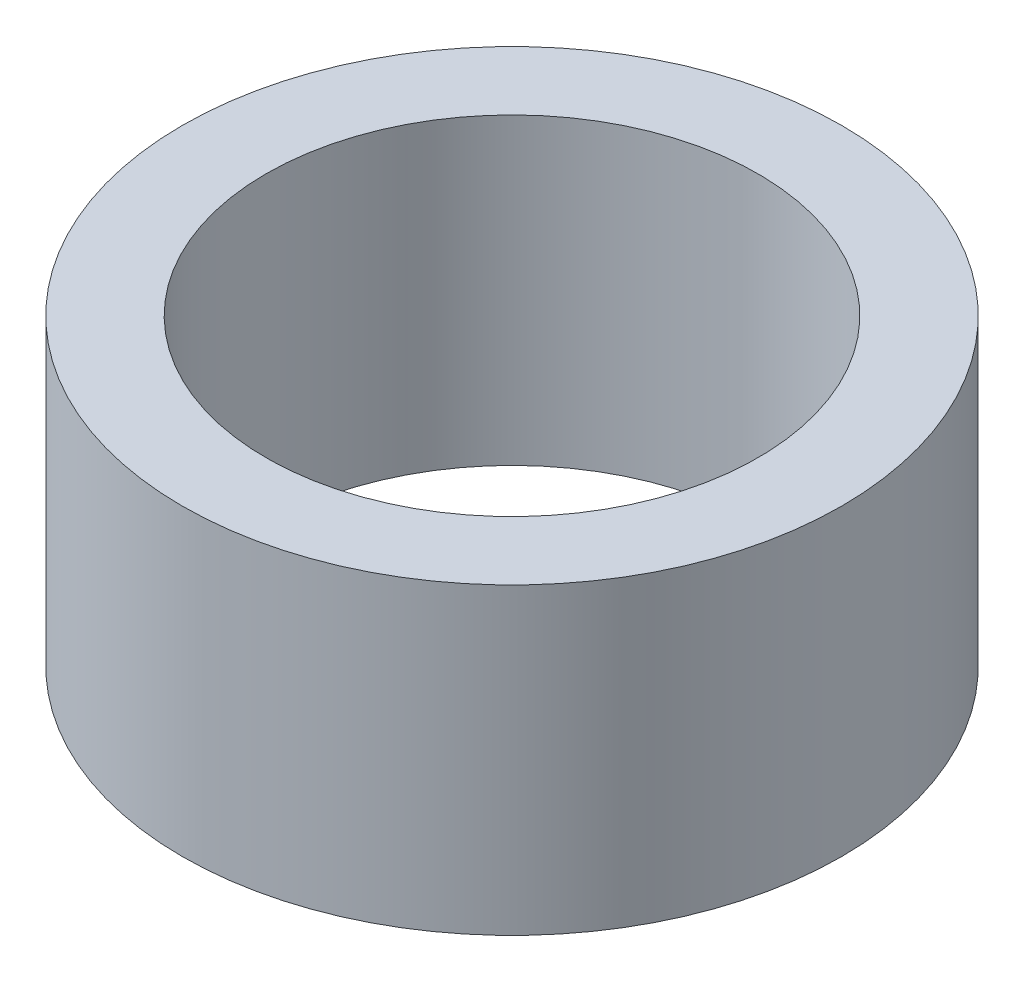
from build123d import *

# Parameters (mm, degrees)
ESQUISSE1_W = 1.6
ESQUISSE1_H = 5.8


with BuildPart() as part:
    # Esquisse1 → Révolution1 (revolve)
    with BuildSketch(Plane.XY, mode=Mode.PRIVATE) as r_volution1_sk:
        with Locations((5.5, 150.649741533)):
            Rectangle(ESQUISSE1_W, ESQUISSE1_H)
    revolve(r_volution1_sk.sketch.rotate(Axis((0, 208.644912312, 0), (0, -1, 0)), 180), axis=Axis((0, 208.644912312, 0), (0, -1, 0)))


solid = part.part
